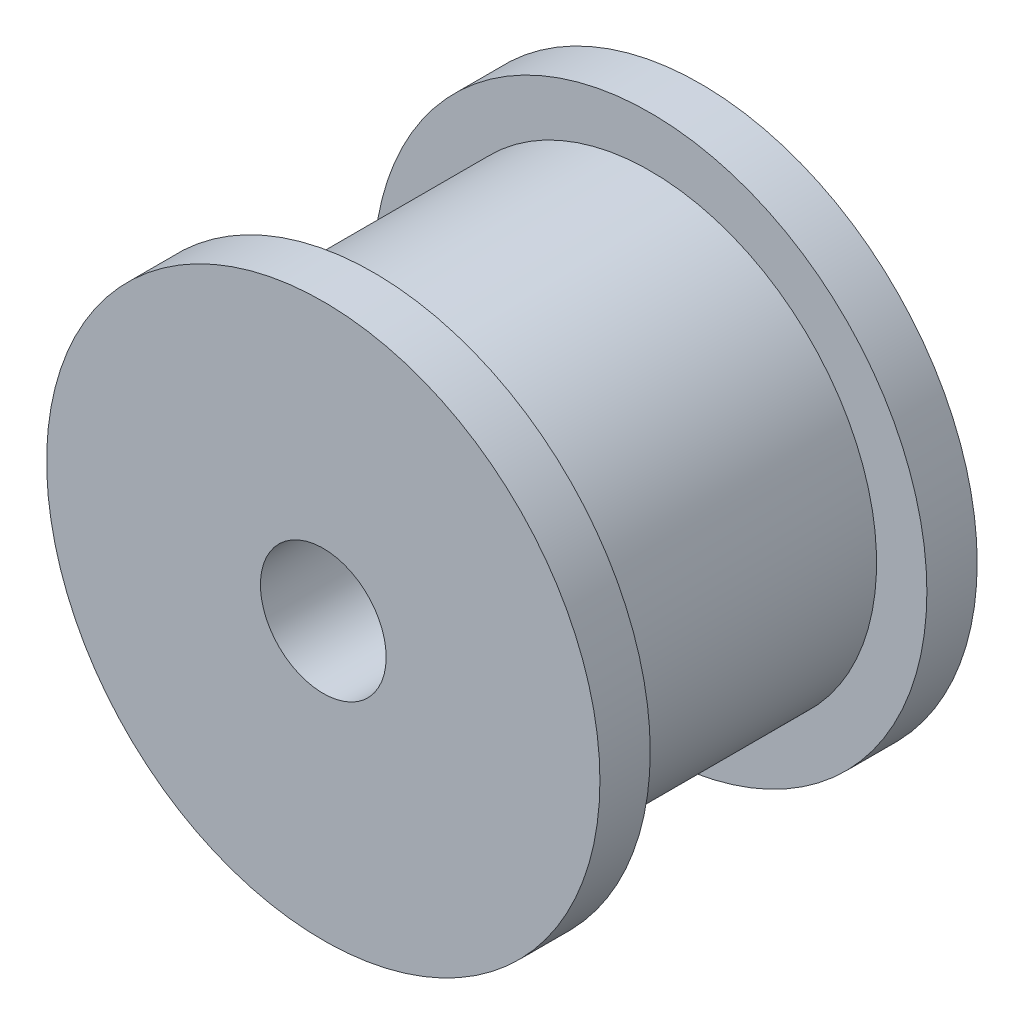
from build123d import *

# Parameters (mm, degrees)
SKETCH_1_R          = 9
EXTRUDE_1_DEPTH     = 15
SKETCH_2_R          = 11
EXTRUDE_2_DEPTH     = 2
SKETCH_3_R          = 2.5
CUT_EXTRUDE_1_DEPTH = 22.610182785


with BuildPart() as part:
    # 草图1 → 凸台-拉伸1 (new body)
    with BuildSketch(Plane.XY):
        Circle(SKETCH_1_R)
    extrude(amount=EXTRUDE_1_DEPTH)

    # 草图2 → 凸台-拉伸2 (add)
    with BuildSketch(Plane.XY.offset(15)):
        Circle(SKETCH_2_R)
    extrude_2 = extrude(amount=-EXTRUDE_2_DEPTH)

    # 镜向1: 凸台-拉伸2 across plane
    add(extrude_2.mirror(Plane(origin=(0, 0, 7.5), x_dir=(1, 0, 0), z_dir=(0, 0, -1))))

    # 草图3 → 切除-拉伸1 (cut, through all)
    with BuildSketch(Plane.XY.offset(15)):
        Circle(SKETCH_3_R)
    extrude(amount=-CUT_EXTRUDE_1_DEPTH, mode=Mode.SUBTRACT)


solid = part.part
